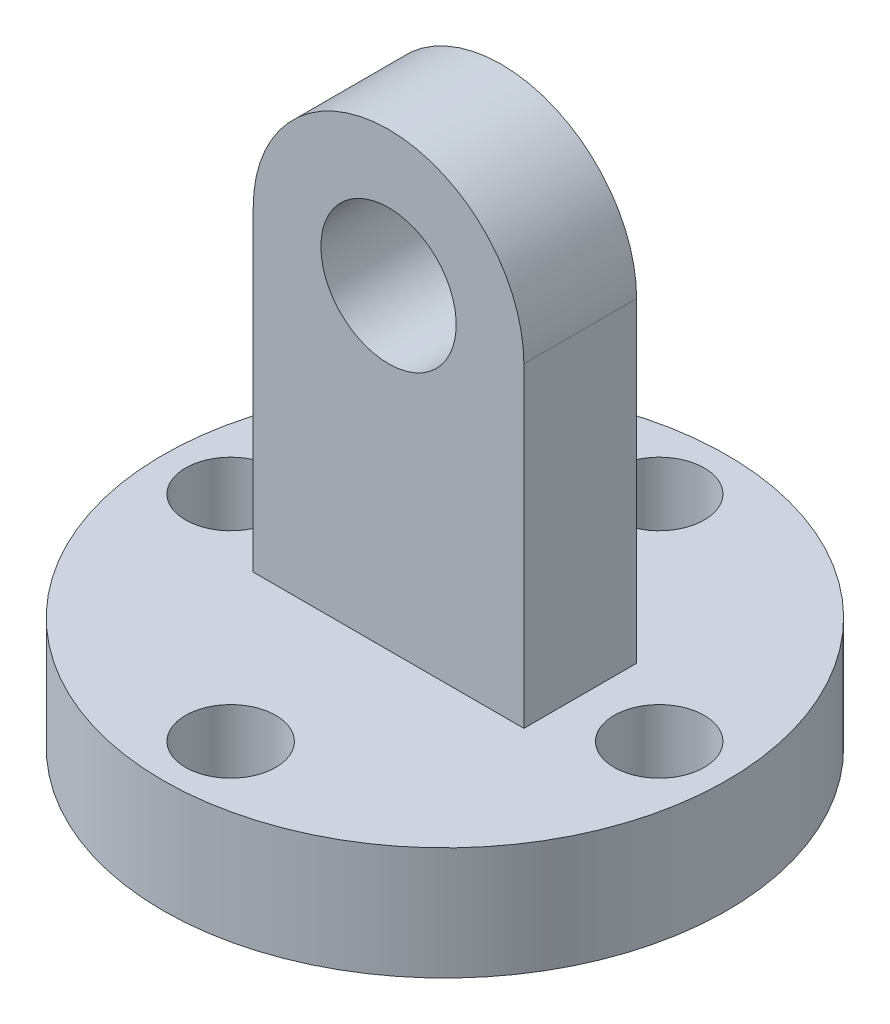
from build123d import *

# Parameters (mm, degrees)
SKETCH_1_R          = 12.5
EXTRUDE_1_DEPTH     = 5
SKETCH_2_R          = 1.1
CUT_EXTRUDE_1_DEPTH = 19.371173071
SKETCH_2_3_R        = 2
CUT_EXTRUDE_2_DEPTH = 3
SKETCH_3_W          = 12
SKETCH_3_H          = 5
EXTRUDE_2_DEPTH     = 20
SKETCH_4_R          = 3
CUT_EXTRUDE_3_DEPTH = 32.721443851


with BuildPart() as part:
    # 草图1 → 凸台-拉伸1 (new body)
    with BuildSketch(Plane(origin=(0, 0, 0), x_dir=(1, 0, 0), z_dir=(0, 1, 0))):
        with Locations(Location((0, 0, 0), (0, 0, 270))):
            Circle(SKETCH_1_R)
    extrude(amount=EXTRUDE_1_DEPTH)

    # 草图2 → 切除-拉伸1 (cut, through all)
    with BuildSketch(Plane(origin=(0, 5, 0), x_dir=(1, 0, 0), z_dir=(0, 1, 0))):
        with Locations(Location((0, -9.5, 0), (0, 0, 270))):
            Circle(SKETCH_2_R)
        with Locations(Location((0, 9.5, 0), (0, 0, 270))):
            Circle(SKETCH_2_R)
        with Locations(Location((9.5, 0, 0), (0, 0, 270))):
            Circle(SKETCH_2_R)
        with Locations(Location((-9.5, 0, 0), (0, 0, 270))):
            Circle(SKETCH_2_R)
    extrude(amount=-CUT_EXTRUDE_1_DEPTH, mode=Mode.SUBTRACT)

    # 草图2<3> → 切除-拉伸2 (cut)
    with BuildSketch(Plane(origin=(0, 5, 0), x_dir=(1, 0, 0), z_dir=(0, 1, 0))):
        with Locations(Location((-9.5, 0, 0), (0, 0, 270))):
            Circle(SKETCH_2_3_R)
        with Locations(Location((0, 9.5, 0), (0, 0, 270))):
            Circle(SKETCH_2_3_R)
        with Locations(Location((9.5, 0, 0), (0, 0, 270))):
            Circle(SKETCH_2_3_R)
        with Locations(Location((0, -9.5, 0), (0, 0, 270))):
            Circle(SKETCH_2_3_R)
    extrude(amount=-CUT_EXTRUDE_2_DEPTH, mode=Mode.SUBTRACT)

    # 草图3 → 凸台-拉伸2 (add)
    with BuildSketch(Plane(origin=(0, 5, 0), x_dir=(1, 0, 0), z_dir=(0, 1, 0))):
        Rectangle(SKETCH_3_W, SKETCH_3_H)
    extrude(amount=EXTRUDE_2_DEPTH)

    # 草图4 → 切除-拉伸3 (cut, through all)
    with BuildSketch(Plane(origin=(0, 0, -2.5), x_dir=(-1, 0, 0), z_dir=(0, 0, -1))):
        with BuildLine():
            ThreePointArc((0, 25), (4.242640687, 23.242640687), (6, 19))
            Line((6, 19), (6, 25))
            Line((6, 25), (0, 25))
        make_face()
        with BuildLine():
            ThreePointArc((-6, 19), (-4.242640687, 23.242640687), (0, 25))
            Line((0, 25), (-6, 25))
            Line((-6, 25), (-6, 19))
        make_face()
        with Locations((0, 19)):
            Circle(SKETCH_4_R)
    extrude(amount=-CUT_EXTRUDE_3_DEPTH, mode=Mode.SUBTRACT)


solid = part.part
